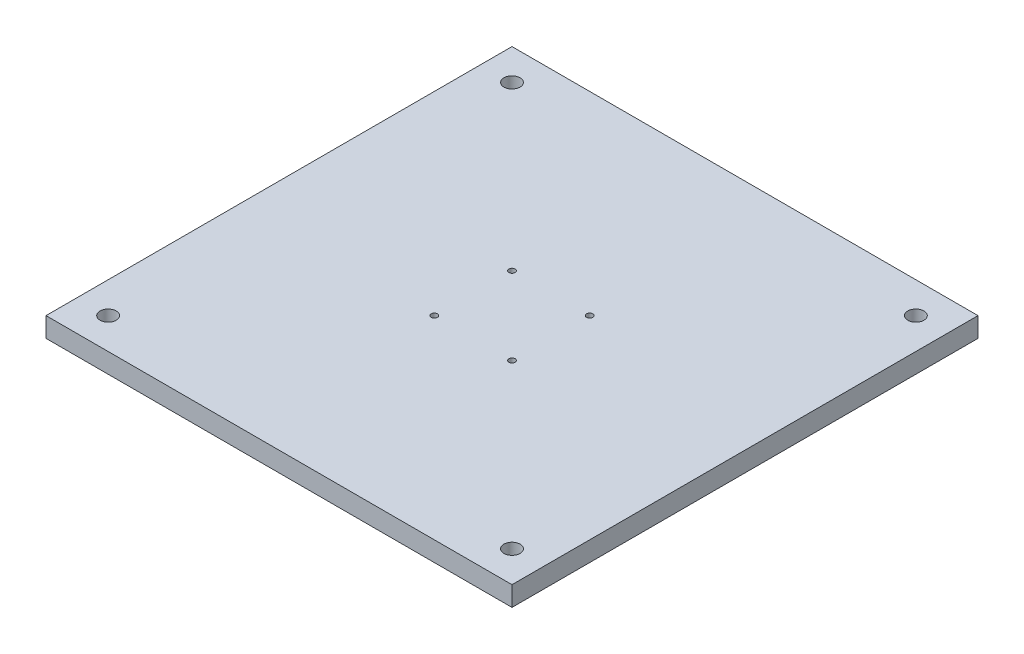
from build123d import *

# Parameters (mm, degrees)
SKETCH2_W           = 150
SKETCH2_H           = 150
SKETCH2_R           = 2.6
SKETCH2_R_2         = 1
BOSS_EXTRUDE1_DEPTH = 6.35


with BuildPart() as part:
    # Sketch2 → Boss-Extrude1 (new body)
    with BuildSketch(Plane(origin=(0, 0, 0), x_dir=(1, 0, 0), z_dir=(0, 1, 0))):
        Rectangle(SKETCH2_W, SKETCH2_H)
        with Locations(Location((-65, 65, 0), (0, 0, 270))):
            Circle(SKETCH2_R, mode=Mode.SUBTRACT)
        with Locations(Location((65, 65, 0), (0, 0, 90))):
            Circle(SKETCH2_R, mode=Mode.SUBTRACT)
        with Locations(Location((65, -65, 0), (0, 0, 270))):
            Circle(SKETCH2_R, mode=Mode.SUBTRACT)
        with Locations(Location((-65, -65, 0), (0, 0, 90))):
            Circle(SKETCH2_R, mode=Mode.SUBTRACT)
        with Locations(Location((-12.5, 12.5, 0), (0, 0, 270))):
            Circle(SKETCH2_R_2, mode=Mode.SUBTRACT)
        with Locations(Location((12.5, 12.5, 0), (0, 0, 90))):
            Circle(SKETCH2_R_2, mode=Mode.SUBTRACT)
        with Locations(Location((12.5, -12.5, 0), (0, 0, 270))):
            Circle(SKETCH2_R_2, mode=Mode.SUBTRACT)
        with Locations(Location((-12.5, -12.5, 0), (0, 0, 90))):
            Circle(SKETCH2_R_2, mode=Mode.SUBTRACT)
    extrude(amount=BOSS_EXTRUDE1_DEPTH)


solid = part.part
